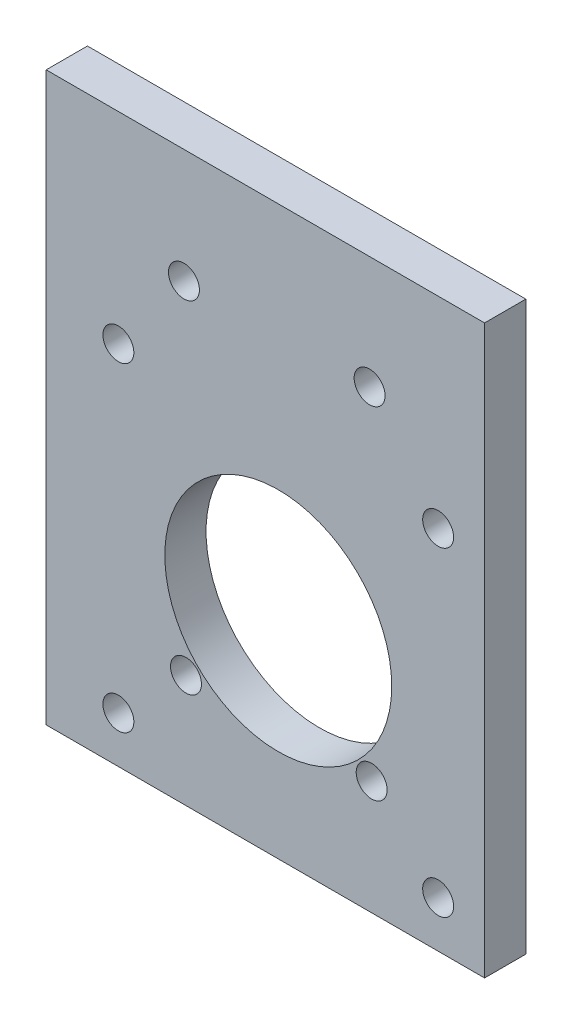
from build123d import *

# Parameters (mm, degrees)
SKETCH1_W           = 42.5
SKETCH1_H           = 40
BOSS_EXTRUDE1_DEPTH = 2
SKETCH2_R           = 1.5
CUT_EXTRUDE1_DEPTH  = 4
SKETCH3_R           = 11
CUT_EXTRUDE2_DEPTH  = 4
SKETCH4_W           = 42.5
SKETCH4_H           = 4
BOSS_EXTRUDE2_DEPTH = 15
SKETCH7_R           = 1.5
CUT_EXTRUDE3_DEPTH  = 10


with BuildPart() as part:
    # Sketch1 → Boss-Extrude1 (new, symmetric)
    with BuildSketch(Plane.XY):
        Rectangle(SKETCH1_W, SKETCH1_H)
    extrude(amount=BOSS_EXTRUDE1_DEPTH, both=True)

    # Sketch2 → Cut-Extrude1 (cut)
    with BuildSketch(Plane(origin=(0, 0, -2), x_dir=(-1, 0, 0), z_dir=(0, 0, -1))):
        with Locations((-16.75, 15.5)):
            Circle(SKETCH2_R)
        with Locations((14.25, 15.5)):
            Circle(SKETCH2_R)
        with Locations((14.25, -15.5)):
            Circle(SKETCH2_R)
        with Locations((-16.75, -15.5)):
            Circle(SKETCH2_R)
    extrude(amount=-CUT_EXTRUDE1_DEPTH, mode=Mode.SUBTRACT)

    # Sketch3 → Cut-Extrude2 (cut)
    with BuildSketch(Plane.XY.offset(2)):
        with Locations((1.25, 0)):
            Circle(SKETCH3_R)
    extrude(amount=-CUT_EXTRUDE2_DEPTH, mode=Mode.SUBTRACT)

    # Sketch4 → Boss-Extrude2 (add)
    with BuildSketch(Plane(origin=(0, 20, 0), x_dir=(1, 0, 0), z_dir=(0, 1, 0))):
        Rectangle(SKETCH4_W, SKETCH4_H)
    extrude(amount=BOSS_EXTRUDE2_DEPTH)

    # Sketch7 → Cut-Extrude3 (cut)
    with BuildSketch(Plane.XY.offset(2)):
        with Locations((-7.894013049, 23.945501151)):
            Circle(SKETCH7_R)
        with Locations((10.105662158, 24.053632735)):
            Circle(SKETCH7_R)
        with Locations((10.303903396, -8.945771811)):
            Circle(SKETCH7_R)
        with Locations((-7.695771811, -9.053903396)):
            Circle(SKETCH7_R)
    extrude(amount=-CUT_EXTRUDE3_DEPTH, mode=Mode.SUBTRACT)


solid = part.part
